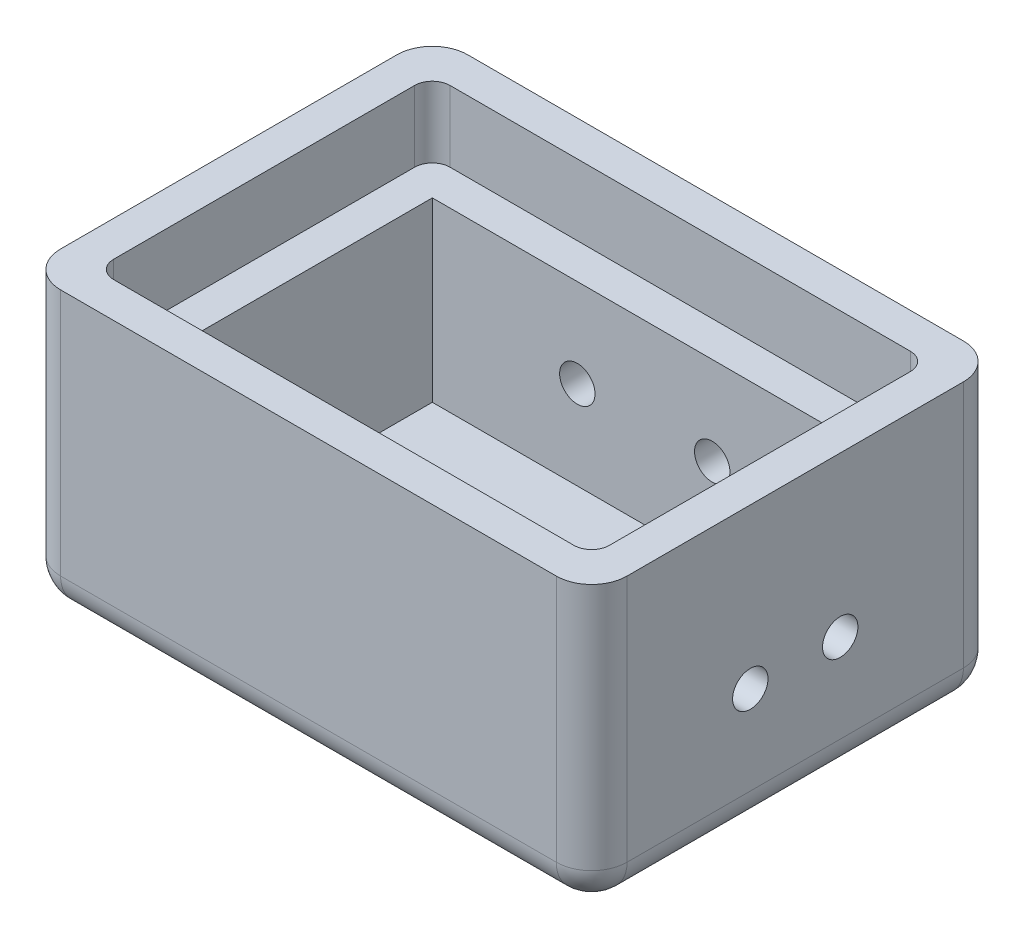
from build123d import *

# Parameters (mm, degrees)
CROQUIS1_W              = 16
CROQUIS1_H              = 11.5
SALIENTE_EXTRUIR2_DEPTH = 8
CROQUIS3_W              = 14
CROQUIS3_H              = 9.5
CORTAR_EXTRUIR2_DEPTH   = 2
CROQUIS4_W              = 12
CROQUIS4_H              = 7.5
CORTAR_EXTRUIR3_DEPTH   = 5
REDONDEO1_R             = 1
REDONDEO2_R             = 0.5
CORTAR_EXTRUIR4_REACH   = 19.119
CROQUIS5_R              = 0.5
CORTAR_EXTRUIR5_REACH   = 16.773
CROQUIS6_R              = 0.5


with BuildPart() as part:
    # Croquis1 → Saliente-Extruir2 (new body)
    with BuildSketch(Plane(origin=(0, 0, 0), x_dir=(1, 0, 0), z_dir=(0, 1, 0))):
        Rectangle(CROQUIS1_W, CROQUIS1_H)
    extrude(amount=SALIENTE_EXTRUIR2_DEPTH)

    # Croquis3 → Cortar-Extruir2 (cut)
    with BuildSketch(Plane(origin=(0, 8, 0), x_dir=(1, 0, 0), z_dir=(0, 1, 0))):
        Rectangle(CROQUIS3_W, CROQUIS3_H)
    extrude(amount=-CORTAR_EXTRUIR2_DEPTH, mode=Mode.SUBTRACT)

    # Croquis4 → Cortar-Extruir3 (cut)
    with BuildSketch(Plane(origin=(0, 6, 0), x_dir=(1, 0, 0), z_dir=(0, 1, 0))):
        Rectangle(CROQUIS4_W, CROQUIS4_H)
    extrude(amount=-CORTAR_EXTRUIR3_DEPTH, mode=Mode.SUBTRACT)

    # Redondeo1
    redondeo1_edges = [part.edges().sort_by_distance(p)[0] for p in [
        (0, 0, 5.75),
        (8, 0, 0),
        (0, 0, -5.75),
        (-8, 0, 0),
        (-8, 4, 5.75),
        (8, 4, 5.75),
        (8, 4, -5.75),
        (-8, 4, -5.75),
    ]]
    fillet(redondeo1_edges, radius=REDONDEO1_R)

    # Redondeo2
    redondeo2_edges = [part.edges().sort_by_distance(p)[0] for p in [
        (7, 7, -4.75),
        (7, 7, 4.75),
        (-7, 7, 4.75),
        (-7, 7, -4.75),
    ]]
    fillet(redondeo2_edges, radius=REDONDEO2_R)

    # Croquis5 → Cortar-Extruir4 (cut, up to next)
    with BuildSketch(Plane.ZY.offset(-6), mode=Mode.PRIVATE) as cortar_extruir4_sk1:
        with Locations((-1.27, 3.5)):
            Circle(CROQUIS5_R)
    cortar_extruir4_tool1 = extrude(cortar_extruir4_sk1.sketch, amount=-CORTAR_EXTRUIR4_REACH, mode=Mode.PRIVATE) & part.part
    # Croquis5 → Cortar-Extruir4 (cut, up to next)
    with BuildSketch(Plane.ZY.offset(-6), mode=Mode.PRIVATE) as cortar_extruir4_sk2:
        with Locations((1.27, 3.5)):
            Circle(CROQUIS5_R)
    cortar_extruir4_tool2 = extrude(cortar_extruir4_sk2.sketch, amount=-CORTAR_EXTRUIR4_REACH, mode=Mode.PRIVATE) & part.part
    add(cortar_extruir4_tool1.solids().sort_by_distance((6, 3.5, -1.27))[0], mode=Mode.SUBTRACT)
    add(cortar_extruir4_tool2.solids().sort_by_distance((6, 3.5, 1.27))[0], mode=Mode.SUBTRACT)

    # Croquis6 → Cortar-Extruir5 (cut, up to next)
    with BuildSketch(Plane.XY.offset(-3.75), mode=Mode.PRIVATE) as cortar_extruir5_sk1:
        with Locations((1.905, 3.5)):
            Circle(CROQUIS6_R)
    cortar_extruir5_tool1 = extrude(cortar_extruir5_sk1.sketch, amount=-CORTAR_EXTRUIR5_REACH, mode=Mode.PRIVATE) & part.part
    # Croquis6 → Cortar-Extruir5 (cut, up to next)
    with BuildSketch(Plane.XY.offset(-3.75), mode=Mode.PRIVATE) as cortar_extruir5_sk2:
        with Locations((-1.905, 3.5)):
            Circle(CROQUIS6_R)
    cortar_extruir5_tool2 = extrude(cortar_extruir5_sk2.sketch, amount=-CORTAR_EXTRUIR5_REACH, mode=Mode.PRIVATE) & part.part
    add(cortar_extruir5_tool1.solids().sort_by_distance((1.905, 3.5, -3.75))[0], mode=Mode.SUBTRACT)
    add(cortar_extruir5_tool2.solids().sort_by_distance((-1.905, 3.5, -3.75))[0], mode=Mode.SUBTRACT)


solid = part.part
